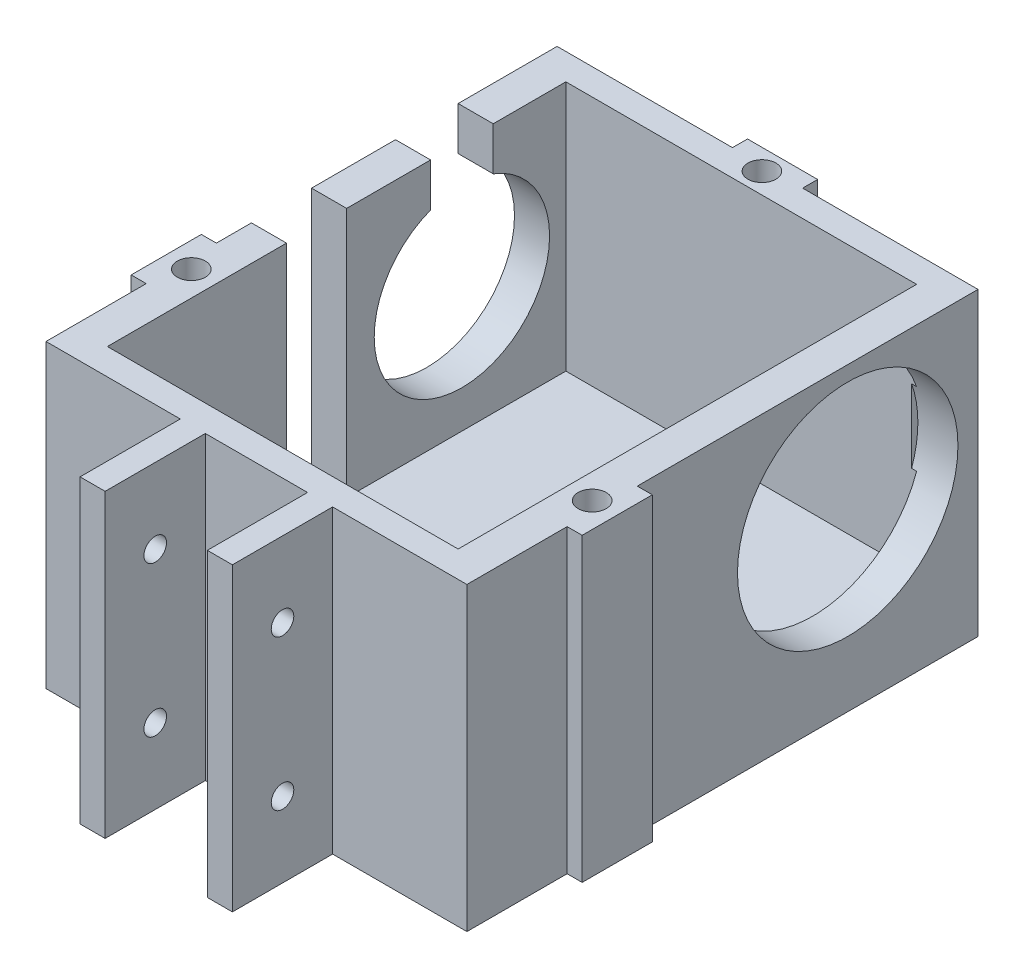
from build123d import *

# Parameters (mm, degrees)
SKETCH1_W            = 42
SKETCH1_H            = 51
BOSS_EXTRUDE1_DEPTH  = 5
SKETCH3_W            = 42
SKETCH3_H            = 51
SKETCH3_W_2          = 35
SKETCH3_H_2          = 45.75
BOSS_EXTRUDE3_DEPTH  = 25
SKETCH4_R            = 8.75
CUT_EXTRUDE2_DEPTH   = 5
CUT_EXTRUDE3_DEPTH   = 4
SKETCH7_W            = 6
SKETCH7_H            = 25
CUT_EXTRUDE4_DEPTH   = 4
SKETCH9_R            = 11
CUT_EXTRUDE5_DEPTH   = 4
SKETCH16_W           = 7
SKETCH16_H           = 30
BOSS_EXTRUDE5_DEPTH  = 1.5
SKETCH19_W           = 7
SKETCH19_H           = 30
BOSS_EXTRUDE7_DEPTH  = 1.5
SKETCH23_W           = 7
SKETCH23_H           = 30
BOSS_EXTRUDE11_DEPTH = 1.5
SKETCH18_R           = 1.4
CUT_EXTRUDE7_DEPTH   = 6
SKETCH20_W           = 2.5
SKETCH20_H           = 30
BOSS_EXTRUDE10_DEPTH = 10
SKETCH22_R           = 1.125
CUT_EXTRUDE8_DEPTH   = 20


with BuildPart() as part:
    # Sketch1 → Boss-Extrude1 (new body)
    with BuildSketch(Plane(origin=(0, 0, 0), x_dir=(1, 0, 0), z_dir=(0, 1, 0))):
        Rectangle(SKETCH1_W, SKETCH1_H)
    extrude(amount=BOSS_EXTRUDE1_DEPTH)

    # Sketch3 → Boss-Extrude3 (add)
    with BuildSketch(Plane(origin=(0, 5, 0), x_dir=(1, 0, 0), z_dir=(0, 1, 0))):
        Rectangle(SKETCH3_W, SKETCH3_H)
        Rectangle(SKETCH3_W_2, SKETCH3_H_2, mode=Mode.SUBTRACT)
    extrude(amount=BOSS_EXTRUDE3_DEPTH)

    # Sketch4 → Cut-Extrude2 (cut)
    with BuildSketch(Plane.ZY.offset(21)):
        with Locations((-12.5, 17.5)):
            Circle(SKETCH4_R)
    extrude(amount=-CUT_EXTRUDE2_DEPTH, mode=Mode.SUBTRACT)

    # Sketch6 → Cut-Extrude3 (cut)
    with BuildSketch(Plane(origin=(-17.5, 0, 0), x_dir=(0, 0, -1), z_dir=(1, 0, 0))):
        with BuildLine():
            Line((9.375, 17.5), (9.375, 30))
            Line((9.375, 30), (15.625, 30))
            Line((15.625, 30), (15.625, 17.5))
            ThreePointArc((15.625, 17.5), (12.5, 14.375), (9.375, 17.5))
        make_face()
    extrude(amount=-CUT_EXTRUDE3_DEPTH, mode=Mode.SUBTRACT)

    # Sketch7 → Cut-Extrude4 (cut)
    with BuildSketch(Plane.ZY.offset(21)):
        with Locations((2, 17.5)):
            Rectangle(SKETCH7_W, SKETCH7_H)
    extrude(amount=-CUT_EXTRUDE4_DEPTH, mode=Mode.SUBTRACT)

    # Sketch9 → Cut-Extrude5 (cut)
    with BuildSketch(Plane(origin=(21, 0, 0), x_dir=(0, 0, -1), z_dir=(1, 0, 0))):
        with Locations((12.5, 17.5)):
            Circle(SKETCH9_R)
    extrude(amount=-CUT_EXTRUDE5_DEPTH, mode=Mode.SUBTRACT)

    # Sketch16 → Boss-Extrude5 (add)
    with BuildSketch(Plane.ZY.offset(21)):
        with Locations((12, 15)):
            Rectangle(SKETCH16_W, SKETCH16_H)
    extrude(amount=BOSS_EXTRUDE5_DEPTH)

    # Sketch19 → Boss-Extrude7 (add)
    with BuildSketch(Plane(origin=(0, 0, -25.5), x_dir=(-1, 0, 0), z_dir=(0, 0, -1))):
        with Locations((0, 15)):
            Rectangle(SKETCH19_W, SKETCH19_H)
    extrude(amount=BOSS_EXTRUDE7_DEPTH)

    # Sketch23 → Boss-Extrude11 (add)
    with BuildSketch(Plane(origin=(21, 0, 0), x_dir=(0, 0, -1), z_dir=(1, 0, 0))):
        with Locations((-12, 15)):
            Rectangle(SKETCH23_W, SKETCH23_H)
    extrude(amount=BOSS_EXTRUDE11_DEPTH)

    # Sketch18 → Cut-Extrude7 (cut)
    with BuildSketch(Plane(origin=(0, 30, 0), x_dir=(1, 0, 0), z_dir=(0, 1, 0))):
        with Locations(Location((-20, -12, 0), (0, 0, 270))):
            Circle(SKETCH18_R)
        with Locations(Location((0, 24.9375, 0), (0, 0, 270))):
            Circle(SKETCH18_R)
        with Locations(Location((20, -12, 0), (0, 0, 90))):
            Circle(SKETCH18_R)
    extrude(amount=-CUT_EXTRUDE7_DEPTH, mode=Mode.SUBTRACT)

    # Sketch20 → Boss-Extrude10 (add)
    with BuildSketch(Plane.XY.offset(25.5)):
        with Locations((-6.35, 15)):
            Rectangle(SKETCH20_W, SKETCH20_H)
        with Locations((6.35, 15)):
            Rectangle(SKETCH20_W, SKETCH20_H)
    extrude(amount=BOSS_EXTRUDE10_DEPTH)

    # Sketch22 → Cut-Extrude8 (cut)
    with BuildSketch(Plane.ZY.offset(7.6)):
        with Locations((30.5, 22.5)):
            Circle(SKETCH22_R)
        with Locations((30.5, 7.5)):
            Circle(SKETCH22_R)
    extrude(amount=-CUT_EXTRUDE8_DEPTH, mode=Mode.SUBTRACT)


solid = part.part
